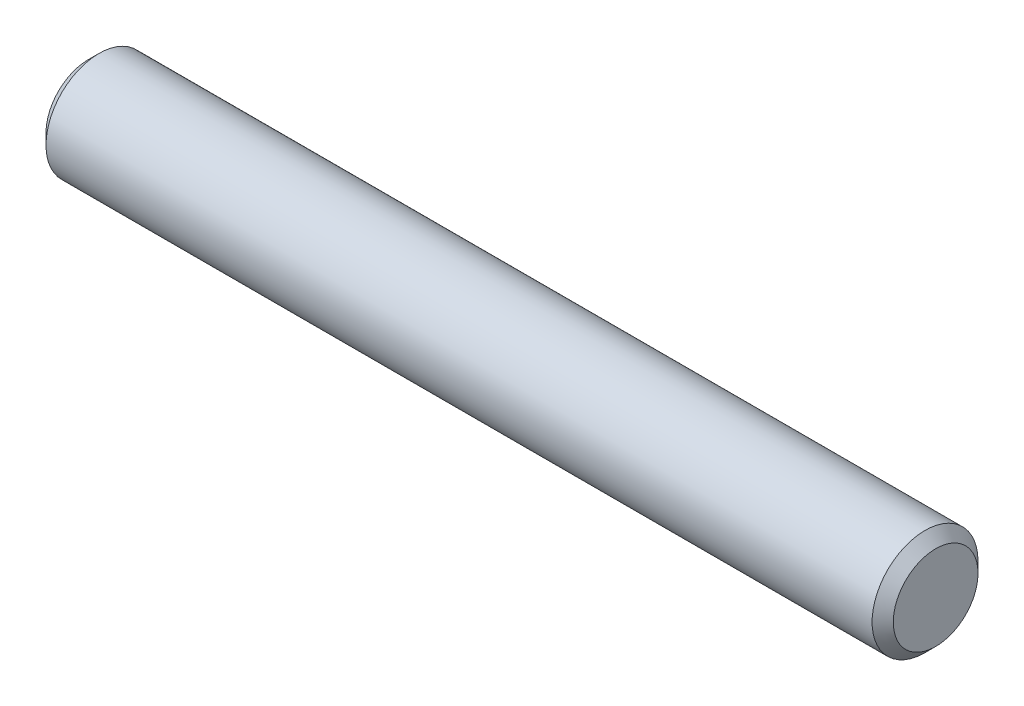
from build123d import *

# Parameters (mm, degrees)
EXTRUDE1_DEPTH      = 12.7
EXTRUDE1_DEPTH_BACK = 12.7
SKETCH2_R           = 1.5875
CHAMFER1_SIZE       = 0.3175


with BuildPart() as part:
    # Sketch2 → Extrude1 (new, two sides: drawn at the far end of the back side and taken through both)
    with BuildSketch(Plane(origin=(0, 0, 0), x_dir=(0, 0, -1), z_dir=(1, 0, 0)).offset(-EXTRUDE1_DEPTH_BACK)):
        Circle(SKETCH2_R)
    extrude(amount=EXTRUDE1_DEPTH + EXTRUDE1_DEPTH_BACK)

    # Chamfer1
    chamfer1_edges = [part.edges().sort_by_distance(p)[0] for p in [
        (-12.7, 0, 1.5875),
        (12.7, 0, 1.5875),
    ]]
    chamfer(chamfer1_edges, length=CHAMFER1_SIZE)


solid = part.part
